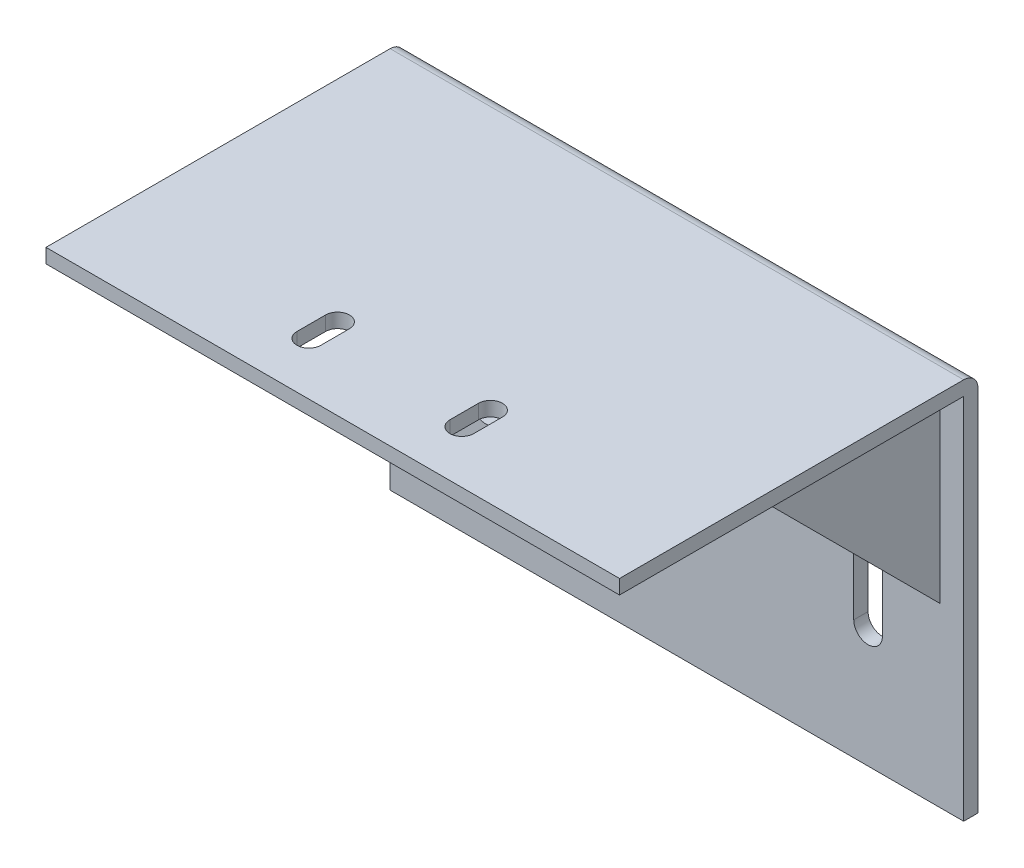
from build123d import *

# Parameters (mm, degrees)
ESQUISSE1_W             = 120
ESQUISSE1_H             = 80
BASE_EXTRUSION_DEPTH    = 3
ESQUISSE2_W             = 120
ESQUISSE2_H             = 3
BOSS_EXTRU_1_DEPTH      = 72
ENL_V_MAT_EXTRU_1_DEPTH = 3
ESQUISSE6_W             = 3
ESQUISSE6_H             = 40
BOSS_EXTRU_2_DEPTH      = 40
ENL_V_MAT_EXTRU_3_DEPTH = 3
ENL_V_MAT_EXTRU_5_DEPTH = 159.902485821
CONG_1_R                = 3


with BuildPart() as part:
    # Esquisse1 → Base-Extrusion (new body)
    with BuildSketch(Plane.XY):
        with Locations((60, 40)):
            Rectangle(ESQUISSE1_W, ESQUISSE1_H)
    extrude(amount=BASE_EXTRUSION_DEPTH)

    # Esquisse2 → Boss.-Extru.1 (add)
    with BuildSketch(Plane.XY.offset(3)):
        with Locations((60, 78.5)):
            Rectangle(ESQUISSE2_W, ESQUISSE2_H)
    extrude(amount=BOSS_EXTRU_1_DEPTH)

    # Esquisse5 → Enlèv. mat.-Extru.1 (cut)
    with BuildSketch(Plane.XY.offset(3)):
        with BuildLine():
            Line((17, 55), (17, 25))
            ThreePointArc((17, 25), (20, 22), (23, 25))
            Line((23, 25), (23, 55))
            ThreePointArc((23, 55), (20, 58), (17, 55))
        make_face()
        with BuildLine():
            Line((97, 55), (97, 25))
            ThreePointArc((97, 25), (100, 22), (103, 25))
            Line((103, 25), (103, 55))
            ThreePointArc((103, 55), (100, 58), (97, 55))
        make_face()
    extrude(amount=-ENL_V_MAT_EXTRU_1_DEPTH, mode=Mode.SUBTRACT)

    # Esquisse6 → Boss.-Extru.2 (add)
    with BuildSketch(Plane.XY.offset(3)):
        with Locations((6.5, 57)):
            Rectangle(ESQUISSE6_W, ESQUISSE6_H)
        with Locations((113.5, 57)):
            Rectangle(ESQUISSE6_W, ESQUISSE6_H)
    extrude(amount=BOSS_EXTRU_2_DEPTH)

    # Esquisse8 → Enlèv. mat.-Extru.3 (cut)
    with BuildSketch(Plane.XZ.offset(-77)):
        with BuildLine():
            Line((41.5, 64), (41.5, 58))
            ThreePointArc((41.5, 58), (44, 55.5), (46.5, 58))
            Line((46.5, 58), (46.5, 64))
            ThreePointArc((46.5, 64), (44, 66.5), (41.5, 64))
        make_face()
        with BuildLine():
            Line((73.5, 64), (73.5, 58))
            ThreePointArc((73.5, 58), (76, 55.5), (78.5, 58))
            Line((78.5, 58), (78.5, 64))
            ThreePointArc((78.5, 64), (76, 66.5), (73.5, 64))
        make_face()
    extrude(amount=-ENL_V_MAT_EXTRU_3_DEPTH, mode=Mode.SUBTRACT)

    # Esquisse10 → Enlèv. mat.-Extru.5 (cut, through all)
    with BuildSketch(Plane.ZY.offset(-5)):
        Polygon((3, 37), (43, 77), (43, 37), align=None)
    extrude(amount=-ENL_V_MAT_EXTRU_5_DEPTH, mode=Mode.SUBTRACT)

    # Congé1
    cong_1_edges = [part.edges().sort_by_distance(p)[0] for p in [
        (60, 80, 0),
    ]]
    fillet(cong_1_edges, radius=CONG_1_R)


solid = part.part
